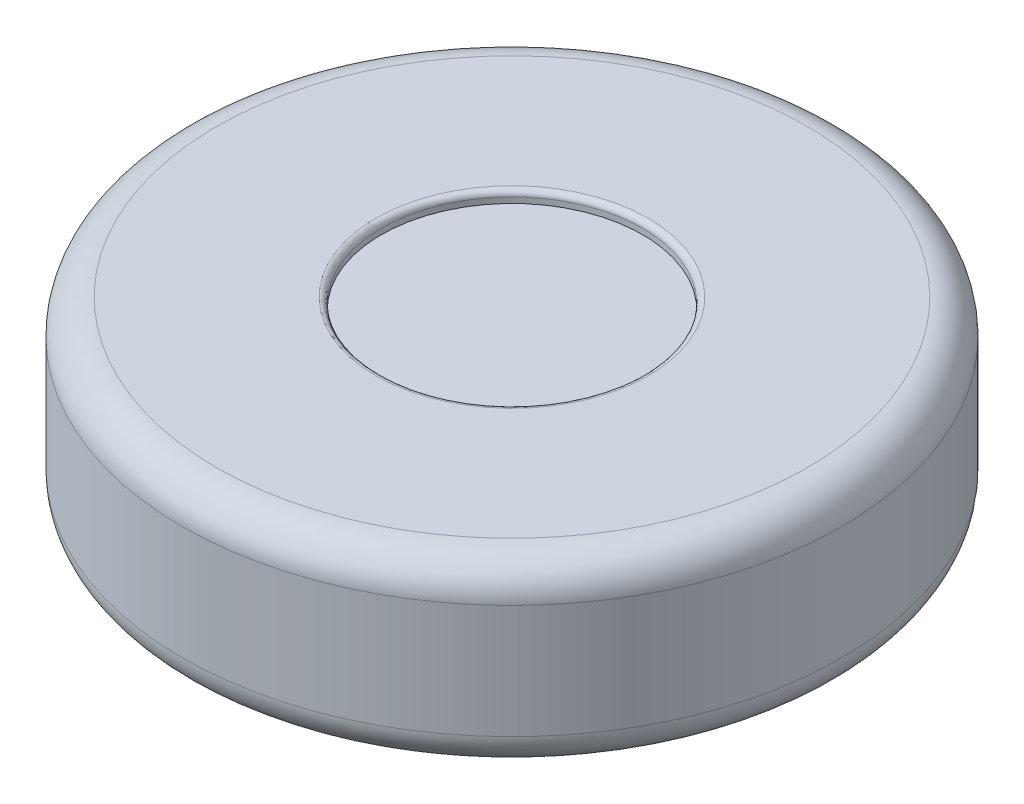
from build123d import *

# Parameters (mm, degrees)
CROQUIS1_R                   = 115
SALIENTE_EXTRUIR1_DEPTH      = 140
SALIENTE_EXTRUIR2_DEPTH      = 80
SALIENTE_EXTRUIR2_DEPTH_BACK = 80
CROQUIS2_R                   = 290
CROQUIS2_R_2                 = 115
REDONDEO1_R                  = 30
REDONDEO2_R                  = 5
REDONDEO3_R                  = 5


with BuildPart() as part:
    # Croquis1 → Saliente-Extruir1 (new body)
    with BuildSketch(Plane(origin=(0, 0, 0), x_dir=(1, 0, 0), z_dir=(0, 1, 0))):
        with Locations(Location((0, 0, 0), (0, 0, 270))):
            Circle(CROQUIS1_R)
    extrude(amount=SALIENTE_EXTRUIR1_DEPTH)

    # Croquis2 → Saliente-Extruir2 (add, two sides: drawn at the far end of the back side and taken through both)
    with BuildSketch(Plane(origin=(0, 70, 0), x_dir=(1, 0, 0), z_dir=(0, 1, 0)).offset(-SALIENTE_EXTRUIR2_DEPTH_BACK)):
        with Locations(Location((0, 0, 0), (0, 0, 270))):
            Circle(CROQUIS2_R)
        with Locations(Location((0, 0, 0), (0, 0, 270))):
            Circle(CROQUIS2_R_2, mode=Mode.SUBTRACT)
    extrude(amount=SALIENTE_EXTRUIR2_DEPTH + SALIENTE_EXTRUIR2_DEPTH_BACK)

    # Redondeo1
    redondeo1_edges = [part.edges().sort_by_distance(p)[0] for p in [
        (0, -10, -290),
        (0, 150, -290),
    ]]
    fillet(redondeo1_edges, radius=REDONDEO1_R)

    # Redondeo2
    redondeo2_edges = [part.edges().sort_by_distance(p)[0] for p in [
        (0, -10, -115),
    ]]
    fillet(redondeo2_edges, radius=REDONDEO2_R)

    # Redondeo3
    redondeo3_edges = [part.edges().sort_by_distance(p)[0] for p in [
        (0, 150, -115),
    ]]
    fillet(redondeo3_edges, radius=REDONDEO3_R)


solid = part.part
